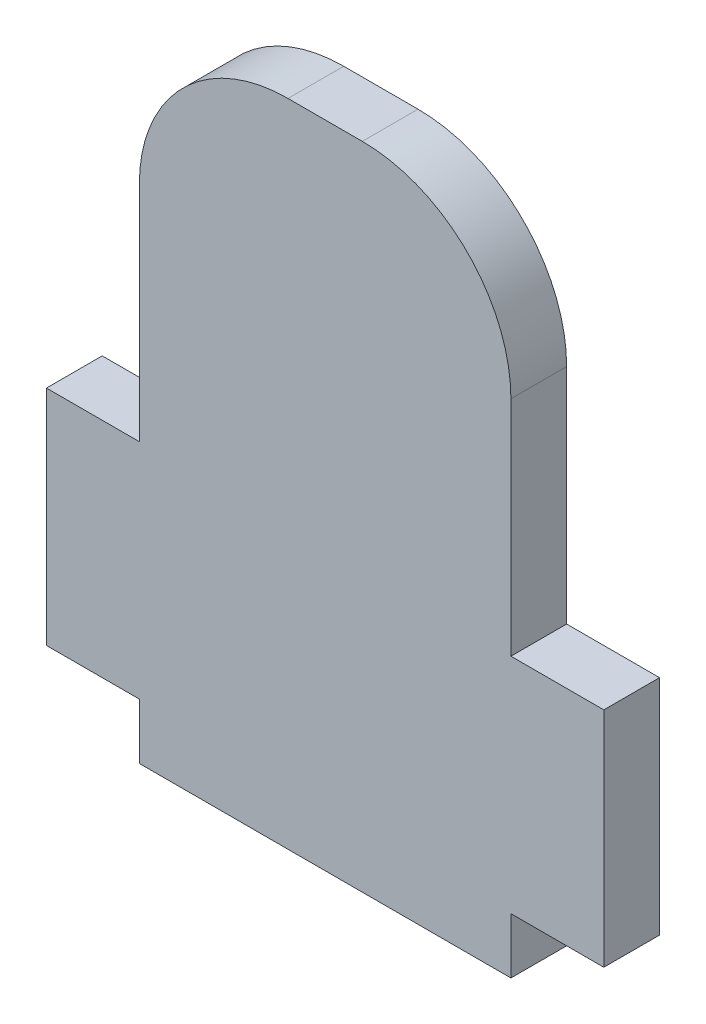
from build123d import *

# Parameters (mm, degrees)
SALIENTE_EXTRUIR1_DEPTH = 3


with BuildPart() as part:
    # Croquis1 → Saliente-Extruir1 (new body)
    with BuildSketch(Plane.XY):
        with BuildLine():
            Line((-10, -2.5), (-10, 9.5))
            ThreePointArc((-10, 9.5), (-7.656854249, 15.156854249), (-2, 17.5))
            Line((-2, 17.5), (2, 17.5))
            ThreePointArc((2, 17.5), (7.656854249, 15.156854249), (10, 9.5))
            Line((10, 9.5), (10, -2.5))
            Line((10, -2.5), (15, -2.5))
            Line((15, -2.5), (15, -14.5))
            Line((15, -14.5), (10, -14.5))
            Line((10, -14.5), (10, -17.5))
            Line((10, -17.5), (-10, -17.5))
            Line((-10, -17.5), (-10, -14.5))
            Line((-10, -14.5), (-15, -14.5))
            Line((-15, -14.5), (-15, -2.5))
            Line((-15, -2.5), (-10, -2.5))
        make_face()
    extrude(amount=SALIENTE_EXTRUIR1_DEPTH)


solid = part.part
